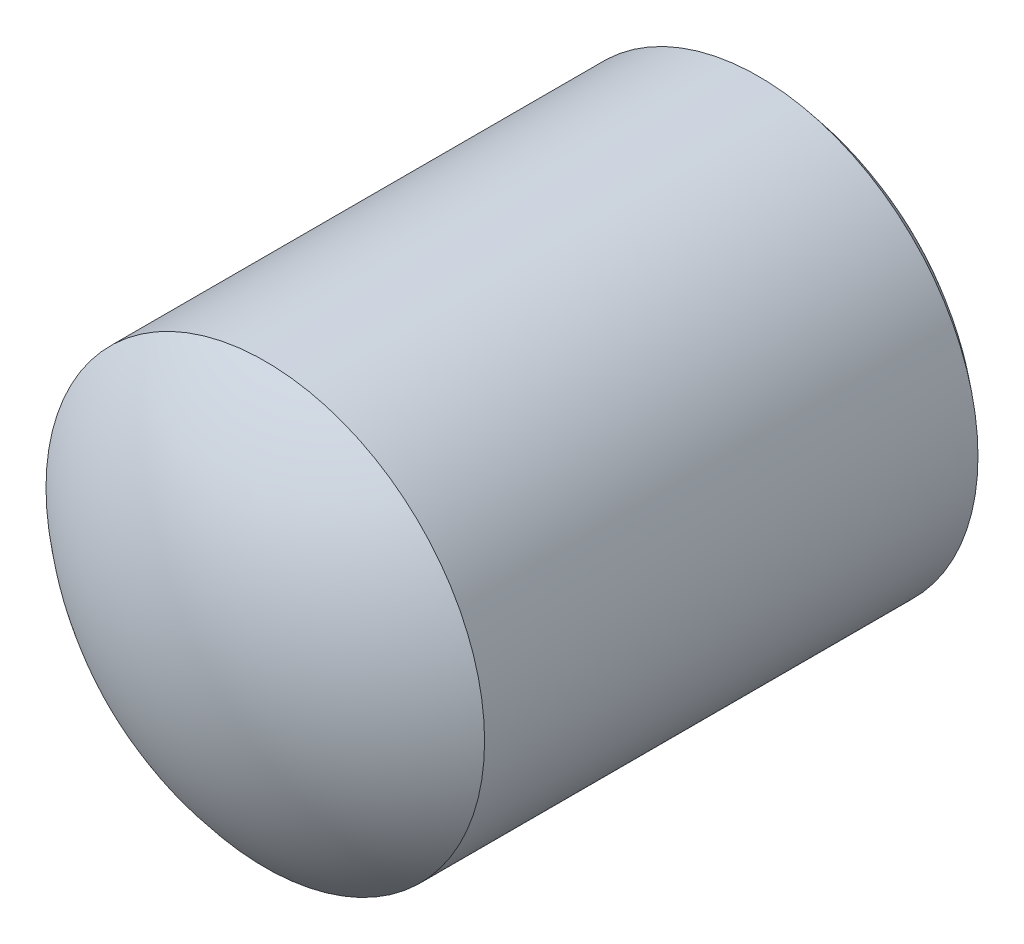
from build123d import *

# Parameters (mm, degrees)
SKETCH1_R           = 400
BOSS_EXTRUDE1_DEPTH = 900
DOME1_FACE_RADIUS   = 400
DOME1_HEIGHT        = 150
DOME2_FACE_RADIUS   = 400
DOME2_HEIGHT        = 150


with BuildPart() as part:
    # Sketch1 → Boss-Extrude1 (new body)
    with BuildSketch(Plane.XY):
        Circle(SKETCH1_R)
    extrude(amount=BOSS_EXTRUDE1_DEPTH)

    # Dome1: a dome of height H over a round flat face of radius A is a cap of a sphere of radius (A * A + H * H) / (2 * H)
    dome1_r = (DOME1_FACE_RADIUS * DOME1_FACE_RADIUS + DOME1_HEIGHT * DOME1_HEIGHT) / (2 * DOME1_HEIGHT)
    dome1_base = Plane((0, 0, 900), z_dir=(0, 0, 1))
    with Locations(dome1_base.offset(DOME1_HEIGHT - dome1_r)):
        dome1_ball = Sphere(dome1_r, mode=Mode.PRIVATE)
    add(split(dome1_ball, bisect_by=dome1_base, keep=Keep.TOP, mode=Mode.PRIVATE))

    # Dome2: a dome of height H over a round flat face of radius A is a cap of a sphere of radius (A * A + H * H) / (2 * H)
    dome2_r = (DOME2_FACE_RADIUS * DOME2_FACE_RADIUS + DOME2_HEIGHT * DOME2_HEIGHT) / (2 * DOME2_HEIGHT)
    dome2_base = Plane((0, 0, 0), z_dir=(0, 0, -1))
    with Locations(dome2_base.offset(DOME2_HEIGHT - dome2_r)):
        dome2_ball = Sphere(dome2_r, mode=Mode.PRIVATE)
    add(split(dome2_ball, bisect_by=dome2_base, keep=Keep.TOP, mode=Mode.PRIVATE))


solid = part.part
